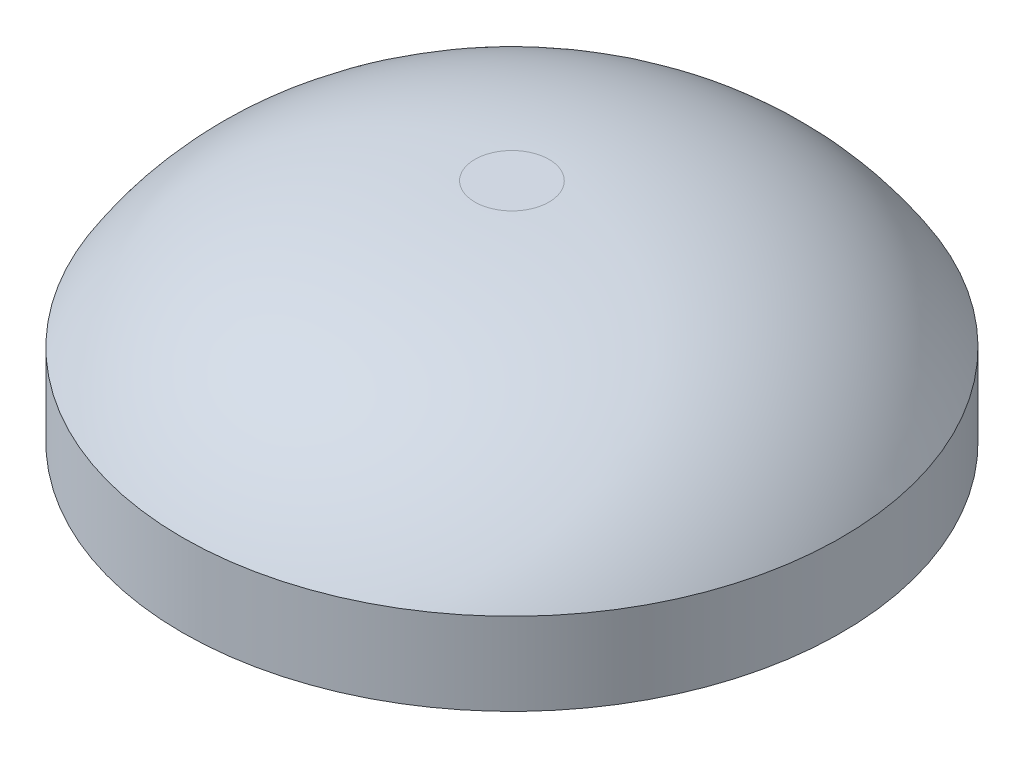
from build123d import *

# Parameters (mm, degrees)
ESQUISSE1_W = 4
ESQUISSE1_H = 1


with BuildPart() as part:
    # Esquisse1 → Révolution1 (revolve)
    with BuildSketch(Plane.XY, mode=Mode.PRIVATE) as r_volution1_sk:
        with BuildLine():
            Line((0, 2.75), (0, 1))
            Line((0, 1), (4, 1))
            add(Edge.make_bspline(
                [(0.449555654, 2.75), (2.945294106, 2.67934827), (4, 1)],
                knots=[0.075570808, 0.075570808, 0.075570808, 0.93592127, 0.93592127, 0.93592127], degree=2))
            Line((0.449555654, 2.75), (0, 2.75))
        make_face()
        with Locations((2, 0.5)):
            Rectangle(ESQUISSE1_W, ESQUISSE1_H)
    revolve(r_volution1_sk.sketch.rotate(Axis((0, 2.75, 0), (0, -1, 0)), 90), axis=Axis((0, 2.75, 0), (0, -1, 0)))


solid = part.part
